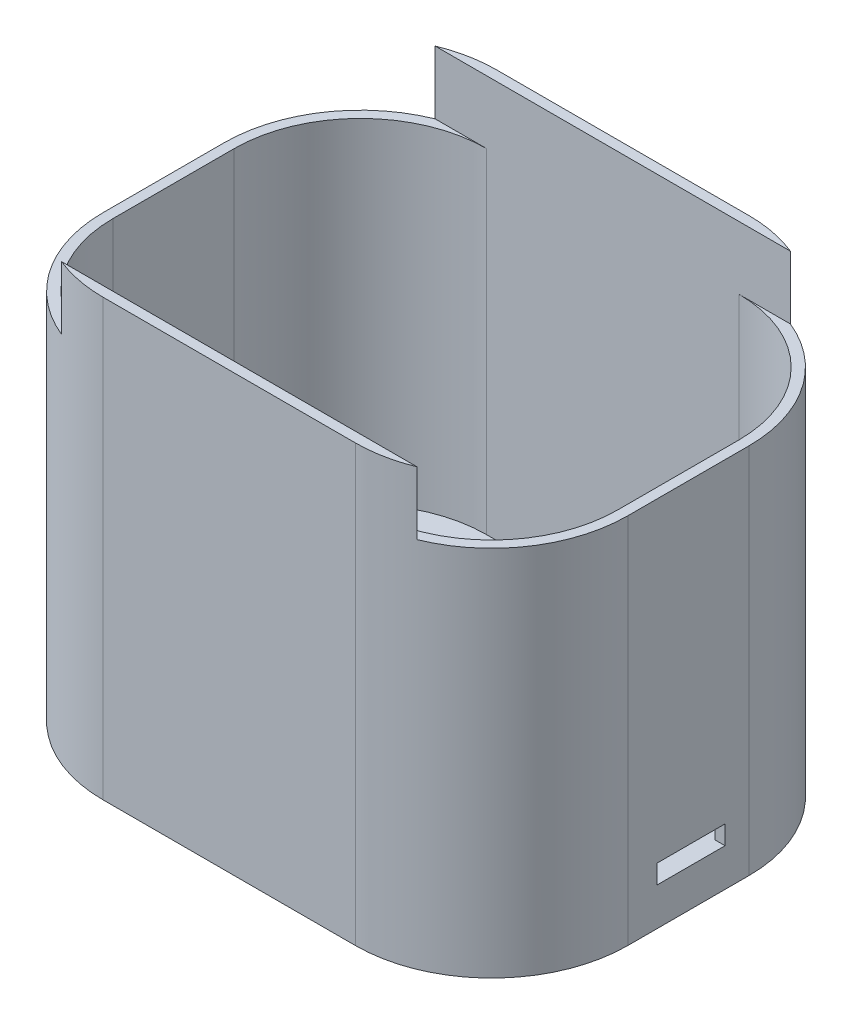
from build123d import *

# Parameters (mm, degrees)
EXTRUDE_1_DEPTH     = 34.5
SKETCH_4_W          = 41.6
SKETCH_4_H          = 29.6
CUT_EXTRUDE_1_DEPTH = 5
EXTRUDE_2_DEPTH     = 3
SKETCH_6_W          = 5.4
SKETCH_6_H          = 1.5
CUT_EXTRUDE_2_DEPTH = 57.250955547
SKETCH_7_R          = 1.22
SKETCH_7_R_2        = 0.91
SKETCH_7_R_3        = 1.3
SKETCH_7_R_4        = 1.68
SKETCH_7_R_5        = 0.95
SKETCH_7_R_6        = 0.85
CUT_EXTRUDE_3_DEPTH = 44.200115741


with BuildPart() as part:
    # 草圖1 → 填料-伸長1 (new body)
    with BuildSketch(Plane(origin=(0, 0, 0), x_dir=(1, 0, 0), z_dir=(0, 1, 0))):
        with BuildLine():
            Line((-10, -15.6), (10, -15.6))
            ThreePointArc((10, -15.6), (17.636753237, -12.436753237), (20.8, -4.8))
            Line((20.8, -4.8), (20.8, 4.8))
            ThreePointArc((20.8, 4.8), (17.636753237, 12.436753237), (10, 15.6))
            Line((10, 15.6), (-10, 15.6))
            ThreePointArc((-10, 15.6), (-17.636753237, 12.436753237), (-20.8, 4.8))
            Line((-20.8, 4.8), (-20.8, -4.8))
            ThreePointArc((-20.8, -4.8), (-17.636753237, -12.436753237), (-10, -15.6))
        make_face()
        with BuildLine():
            Line((-10, -14.8), (10, -14.8))
            ThreePointArc((10, -14.8), (17.071067812, -11.871067812), (20, -4.8))
            Line((20, -4.8), (20, 4.8))
            ThreePointArc((20, 4.8), (17.071067812, 11.871067812), (10, 14.8))
            Line((10, 14.8), (-10, 14.8))
            ThreePointArc((-10, 14.8), (-17.071067812, 11.871067812), (-20, 4.8))
            Line((-20, 4.8), (-20, -4.8))
            ThreePointArc((-20, -4.8), (-17.071067812, -11.871067812), (-10, -14.8))
        make_face(mode=Mode.SUBTRACT)
    extrude(amount=EXTRUDE_1_DEPTH)

    # 草圖4 → 除料-伸長1 (cut)
    with BuildSketch(Plane(origin=(0, 34.5, 0), x_dir=(1, 0, 0), z_dir=(0, 1, 0))):
        Rectangle(SKETCH_4_W, SKETCH_4_H)
    extrude(amount=-CUT_EXTRUDE_1_DEPTH, mode=Mode.SUBTRACT)

    # 草圖5 → 填料-伸長2 (add)
    with BuildSketch(Plane.XZ):
        with BuildLine():
            Line((20, 4.8), (20, -4.8))
            ThreePointArc((20, -4.8), (17.071067812, -11.871067812), (10, -14.8))
            Line((10, -14.8), (-10, -14.8))
            ThreePointArc((-10, -14.8), (-17.071067812, -11.871067812), (-20, -4.8))
            Line((-20, -4.8), (-20, 4.8))
            ThreePointArc((-20, 4.8), (-17.071067812, 11.871067812), (-10, 14.8))
            Line((-10, 14.8), (10, 14.8))
            ThreePointArc((10, 14.8), (17.071067812, 11.871067812), (20, 4.8))
        make_face()
    extrude(amount=-EXTRUDE_2_DEPTH)

    # 草圖6 → 除料-伸長2 (cut, through all)
    with BuildSketch(Plane(origin=(20.8, 0, 0), x_dir=(0, 0, -1), z_dir=(1, 0, 0))):
        with Locations((0.2, 3.75)):
            Rectangle(SKETCH_6_W, SKETCH_6_H)
    extrude(amount=-CUT_EXTRUDE_2_DEPTH, mode=Mode.SUBTRACT)

    # 草圖7 → 除料-伸長3 (cut, through all)
    with BuildSketch(Plane.XZ):
        with Locations(Location((0, 0, 0), (0, 0, 270))):
            Circle(SKETCH_7_R)
        with Locations(Location((4, 0, 0), (0, 0, 270))):
            Circle(SKETCH_7_R_2)
        with Locations(Location((8, 0, 0), (0, 0, 270))):
            Circle(SKETCH_7_R_3)
        with Locations(Location((-4, 0, 0), (0, 0, 270))):
            Circle(SKETCH_7_R_2)
        with Locations(Location((-8, 0, 0), (0, 0, 270))):
            Circle(SKETCH_7_R_4)
        with Locations(Location((-12, 0, 0), (0, 0, 270))):
            Circle(SKETCH_7_R_5)
        with Locations(Location((12, 0, 0), (0, 0, 270))):
            Circle(SKETCH_7_R_6)
    extrude(amount=-CUT_EXTRUDE_3_DEPTH, mode=Mode.SUBTRACT)


solid = part.part
